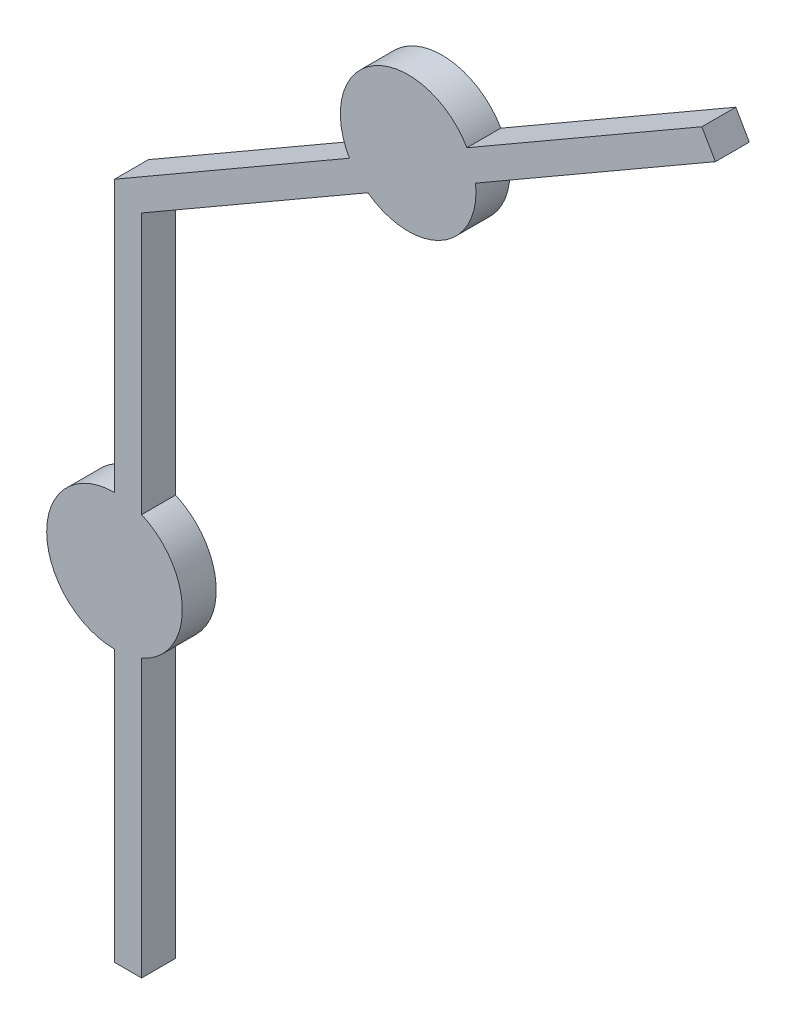
from build123d import *

# Parameters (mm, degrees)
EXTRUDE_THIN1_DEPTH = 1.5
SKETCH2_R           = 3
BOSS_EXTRUDE1_DEPTH = 1.5


with BuildPart() as part:
    # Sketch1 → Extrude-Thin1 (new body)
    with BuildSketch(Plane.XY):
        Polygon((0, 0), (0, 30), (25.980762114, 45), (26.580762114, 43.960769515), (1.2, 29.307179677), (1.2, 0), align=None)
    extrude(amount=EXTRUDE_THIN1_DEPTH)

    # Sketch2 → Boss-Extrude1 (add)
    with BuildSketch(Plane.XY):
        with Locations((12.990381057, 37.5)):
            Circle(SKETCH2_R)
        with Locations((0, 15)):
            Circle(SKETCH2_R)
    extrude(amount=BOSS_EXTRUDE1_DEPTH)


solid = part.part
